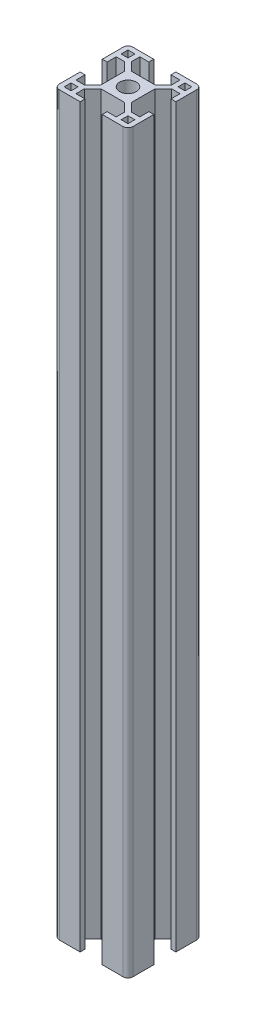
from build123d import *

# Parameters (mm, degrees)
SKETCH1_W           = 20
SKETCH1_H           = 20
EXTRUDE1_DEPTH      = 200
SKETCH2_R           = 2.266666667
SKETCH2_W           = 1.866666667
SKETCH2_H           = 1.866666667
EXTRUDE2_DEPTH      = 201.499376558
FILLET1_R           = 1.333333333
SKETCH_1_R          = 2.5
CUT_EXTRUDE_1_DEPTH = 202.246117975


with BuildPart() as part:
    # Sketch1 → Extrude1 (new body)
    with BuildSketch(Plane(origin=(0, 0, 0), x_dir=(1, 0, 0), z_dir=(0, 1, 0))):
        Rectangle(SKETCH1_W, SKETCH1_H)
    extrude(amount=EXTRUDE1_DEPTH)

    # Sketch2 → Extrude2 (cut, through all)
    with BuildSketch(Plane(origin=(0, 200, 0), x_dir=(1, 0, 0), z_dir=(0, 1, 0))):
        Circle(SKETCH2_R)
        Polygon((8.666666667, 3), (11.333333333, 3), (11.333333333, -3), (8.666666667, -3), (8.666666667, -5.466666667), (6.409475708, -5.466666667), (4.133333333, -3.190524292), (4.133333333, 3.190524292), (6.409475708, 5.466666667), (8.666666667, 5.466666667), align=None)
        with Locations((7.733333334, 7.733333334)):
            Rectangle(SKETCH2_W, SKETCH2_H)
        Polygon((-3.190524292, 4.133333333), (-5.466666667, 6.409475708), (-5.466666667, 8.666666667), (-3, 8.666666667), (-3, 11.333333333), (3, 11.333333333), (3, 8.666666667), (5.466666667, 8.666666667), (5.466666667, 6.409475708), (3.190524292, 4.133333333), align=None)
        with Locations((7.733333334, -7.733333334)):
            Rectangle(SKETCH2_W, SKETCH2_H)
        with Locations((-7.733333334, 7.733333334)):
            Rectangle(SKETCH2_W, SKETCH2_H)
        with Locations((-7.733333334, -7.733333334)):
            Rectangle(SKETCH2_W, SKETCH2_H)
        Polygon((-6.409475708, -5.466666667), (-8.666666667, -5.466666667), (-8.666666667, -3), (-11.333333333, -3), (-11.333333333, 3), (-8.666666667, 3), (-8.666666667, 5.466666667), (-6.409475708, 5.466666667), (-4.133333333, 3.190524292), (-4.133333333, -3.190524292), align=None)
        Polygon((3.190524292, -4.133333333), (-3.190524292, -4.133333333), (-5.466666667, -6.409475708), (-5.466666667, -8.666666667), (-3, -8.666666667), (-3, -11.333333333), (3, -11.333333333), (3, -8.666666667), (5.466666667, -8.666666667), (5.466666667, -6.409475708), align=None)
    extrude(amount=-EXTRUDE2_DEPTH, mode=Mode.SUBTRACT)

    # Fillet1
    fillet1_edges = [part.edges().sort_by_distance(p)[0] for p in [
        (10, 100, 10),
        (10, 100, -10),
        (-10, 100, 10),
        (-10, 100, -10),
    ]]
    fillet(fillet1_edges, radius=FILLET1_R)

    # Эскиз1 → Вырез-Вытянуть1 (cut, through all)
    with BuildSketch(Plane(origin=(10, 0, 0), x_dir=(0, 0, -1), z_dir=(1, 0, 0))):
        with Locations((0, 93)):
            Circle(SKETCH_1_R)
        with Locations((0, 107)):
            Circle(SKETCH_1_R)
    extrude(amount=-CUT_EXTRUDE_1_DEPTH, mode=Mode.SUBTRACT)


solid = part.part
